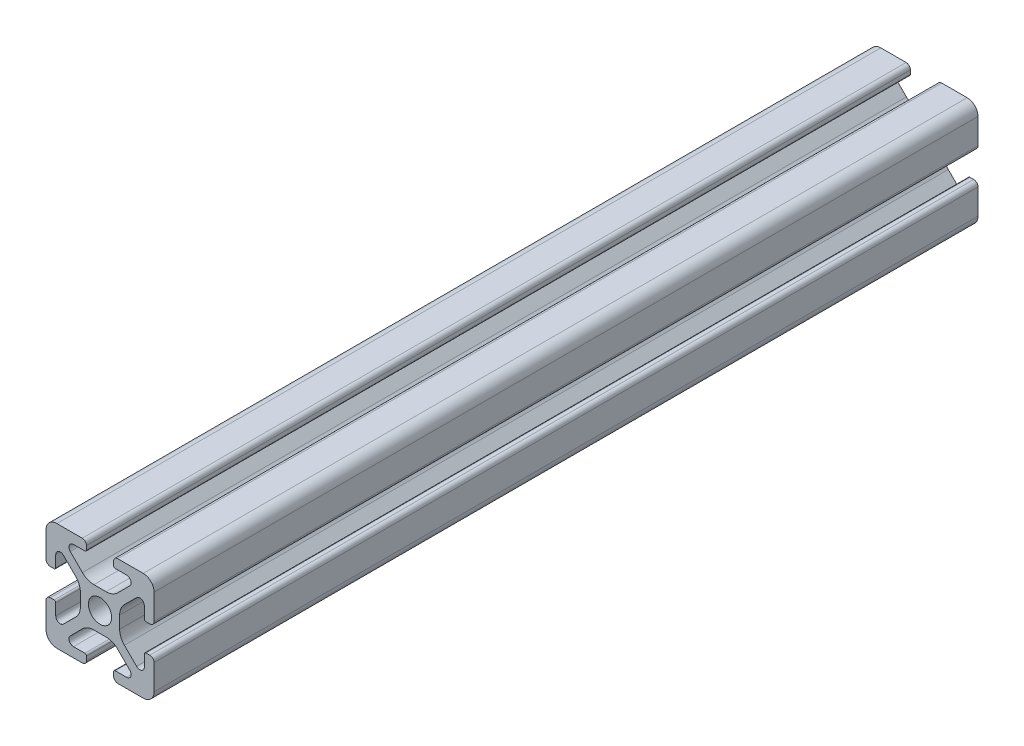
from build123d import *

# Parameters (mm, degrees)
SKETCH1_R           = 2.1463
BOSS_EXTRUDE1_DEPTH = 76.2


with BuildPart() as part:
    # Sketch1 → Boss-Extrude1 (new, symmetric)
    with BuildSketch(Plane.XY):
        with BuildLine():
            Line((-9.9949, 7.9883), (-9.9949, 3.2893))
            ThreePointArc((-9.9949, 3.2893), (-9.76427588, 2.73252412), (-9.2075, 2.5019))
            Line((-9.2075, 2.5019), (-8.4963, 2.5019))
            ThreePointArc((-8.4963, 2.5019), (-8.280773853, 2.591173853), (-8.1915, 2.8067))
            Line((-8.1915, 2.8067), (-8.1915, 4.9149))
            ThreePointArc((-8.1915, 4.9149), (-7.674065253, 5.689295824), (-6.760603096, 5.507596904))
            Line((-6.760603096, 5.507596904), (-4.505765747, 3.252759555))
            ThreePointArc((-4.505765747, 3.252759555), (-3.856054457, 2.280397894), (-3.627906192, 1.133419111))
            Line((-3.627906192, 1.133419111), (-3.627906192, -1.133419111))
            ThreePointArc((-3.627906192, -1.133419111), (-3.856054457, -2.280397894), (-4.505765747, -3.252759555))
            Line((-4.505765747, -3.252759555), (-6.760603096, -5.507596904))
            ThreePointArc((-6.760603096, -5.507596904), (-7.674065253, -5.689295824), (-8.1915, -4.9149))
            Line((-8.1915, -4.9149), (-8.1915, -2.8067))
            ThreePointArc((-8.1915, -2.8067), (-8.280773853, -2.591173853), (-8.4963, -2.5019))
            Line((-8.4963, -2.5019), (-9.2075, -2.5019))
            ThreePointArc((-9.2075, -2.5019), (-9.76427588, -2.73252412), (-9.9949, -3.2893))
            Line((-9.9949, -3.2893), (-9.9949, -7.9883))
            ThreePointArc((-9.9949, -7.9883), (-9.407180467, -9.407180467), (-7.9883, -9.9949))
            Line((-7.9883, -9.9949), (-3.2893, -9.9949))
            ThreePointArc((-3.2893, -9.9949), (-2.73252412, -9.76427588), (-2.5019, -9.2075))
            Line((-2.5019, -9.2075), (-2.5019, -8.4963))
            ThreePointArc((-2.5019, -8.4963), (-2.591173853, -8.280773853), (-2.8067, -8.1915))
            Line((-2.8067, -8.1915), (-4.9149, -8.1915))
            ThreePointArc((-4.9149, -8.1915), (-5.689295824, -7.674065253), (-5.507596904, -6.760603096))
            Line((-5.507596904, -6.760603096), (-3.252759555, -4.505765747))
            ThreePointArc((-3.252759555, -4.505765747), (-2.280397894, -3.856054457), (-1.133419111, -3.627906192))
            Line((-1.133419111, -3.627906192), (1.133419111, -3.627906192))
            ThreePointArc((1.133419111, -3.627906192), (2.280397894, -3.856054457), (3.252759555, -4.505765747))
            Line((3.252759555, -4.505765747), (5.507596904, -6.760603096))
            ThreePointArc((5.507596904, -6.760603096), (5.689295824, -7.674065253), (4.9149, -8.1915))
            Line((4.9149, -8.1915), (2.8067, -8.1915))
            ThreePointArc((2.8067, -8.1915), (2.591173853, -8.280773853), (2.5019, -8.4963))
            Line((2.5019, -8.4963), (2.5019, -9.2075))
            ThreePointArc((2.5019, -9.2075), (2.73252412, -9.76427588), (3.2893, -9.9949))
            Line((3.2893, -9.9949), (7.9883, -9.9949))
            ThreePointArc((7.9883, -9.9949), (9.407180467, -9.407180467), (9.9949, -7.9883))
            Line((9.9949, -7.9883), (9.9949, -3.2893))
            ThreePointArc((9.9949, -3.2893), (9.76427588, -2.73252412), (9.2075, -2.5019))
            Line((9.2075, -2.5019), (8.4963, -2.5019))
            ThreePointArc((8.4963, -2.5019), (8.280773853, -2.591173853), (8.1915, -2.8067))
            Line((8.1915, -2.8067), (8.1915, -4.9149))
            ThreePointArc((8.1915, -4.9149), (7.674065253, -5.689295824), (6.760603096, -5.507596904))
            Line((6.760603096, -5.507596904), (4.505765747, -3.252759555))
            ThreePointArc((4.505765747, -3.252759555), (3.856054457, -2.280397894), (3.627906192, -1.133419111))
            Line((3.627906192, -1.133419111), (3.627906192, 1.133419111))
            ThreePointArc((3.627906192, 1.133419111), (3.856054457, 2.280397894), (4.505765747, 3.252759555))
            Line((4.505765747, 3.252759555), (6.760603096, 5.507596904))
            ThreePointArc((6.760603096, 5.507596904), (7.674065253, 5.689295824), (8.1915, 4.9149))
            Line((8.1915, 4.9149), (8.1915, 2.8067))
            ThreePointArc((8.1915, 2.8067), (8.280773853, 2.591173853), (8.4963, 2.5019))
            Line((8.4963, 2.5019), (9.2075, 2.5019))
            ThreePointArc((9.2075, 2.5019), (9.76427588, 2.73252412), (9.9949, 3.2893))
            Line((9.9949, 3.2893), (9.9949, 7.9883))
            ThreePointArc((9.9949, 7.9883), (9.407180467, 9.407180467), (7.9883, 9.9949))
            Line((7.9883, 9.9949), (3.2893, 9.9949))
            ThreePointArc((3.2893, 9.9949), (2.73252412, 9.76427588), (2.5019, 9.2075))
            Line((2.5019, 9.2075), (2.5019, 8.4963))
            ThreePointArc((2.5019, 8.4963), (2.591173853, 8.280773853), (2.8067, 8.1915))
            Line((2.8067, 8.1915), (4.9149, 8.1915))
            ThreePointArc((4.9149, 8.1915), (5.689295824, 7.674065253), (5.507596904, 6.760603096))
            Line((5.507596904, 6.760603096), (3.252759555, 4.505765747))
            ThreePointArc((3.252759555, 4.505765747), (2.280397894, 3.856054457), (1.133419111, 3.627906192))
            Line((1.133419111, 3.627906192), (-1.133419111, 3.627906192))
            ThreePointArc((-1.133419111, 3.627906192), (-2.280397894, 3.856054457), (-3.252759555, 4.505765747))
            Line((-3.252759555, 4.505765747), (-5.507596904, 6.760603096))
            ThreePointArc((-5.507596904, 6.760603096), (-5.689295824, 7.674065253), (-4.9149, 8.1915))
            Line((-4.9149, 8.1915), (-2.8067, 8.1915))
            ThreePointArc((-2.8067, 8.1915), (-2.591173853, 8.280773853), (-2.5019, 8.4963))
            Line((-2.5019, 8.4963), (-2.5019, 9.2075))
            ThreePointArc((-2.5019, 9.2075), (-2.73252412, 9.76427588), (-3.2893, 9.9949))
            Line((-3.2893, 9.9949), (-7.9883, 9.9949))
            ThreePointArc((-7.9883, 9.9949), (-9.407180467, 9.407180467), (-9.9949, 7.9883))
        make_face()
        with Locations(Location((0, 0, 0), (0, 0, 180))):
            Circle(SKETCH1_R, mode=Mode.SUBTRACT)
    extrude(amount=BOSS_EXTRUDE1_DEPTH, both=True)


solid = part.part
